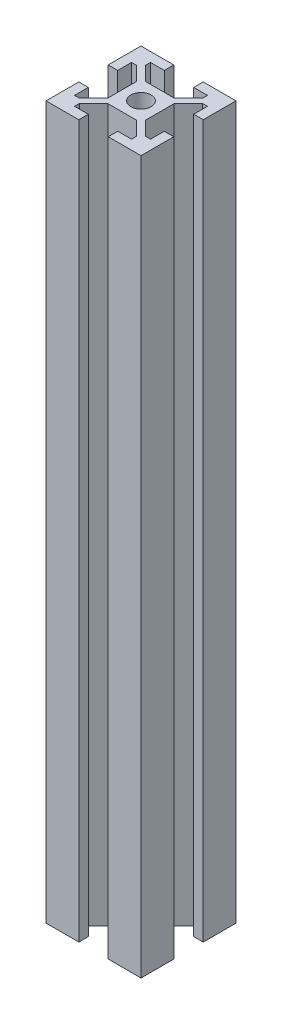
from build123d import *

# Parameters (mm, degrees)
SKETCH_1_R          = 2.15
EXTRUDE_1_DEPTH     = 150
SKETCH_3_R          = 3
CUT_EXTRUDE_1_DEPTH = 26


with BuildPart() as part:
    # 스케치1 → 보스-돌출1 (new body)
    with BuildSketch(Plane(origin=(0, 0, 0), x_dir=(1, 0, 0), z_dir=(0, 1, 0))):
        Polygon((3.1, 8), (6, 8), (6, 7), (3, 4), (0, 4), (-3, 4), (-6, 7), (-6, 8), (-3.1, 8), (-3.1, 9.998992087), (-10.001007855, 9.998992087), (-10.001007855, 3.1), (-8, 3.1), (-8, 6), (-7, 6), (-4, 3), (-4, 0), (-4, -3), (-7, -6), (-8, -6), (-8, -3.1), (-10.001007855, -3.1), (-10.001007855, -9.998992087), (-3.1, -9.998992087), (-3.1, -8), (-6, -8), (-6, -7), (-3, -4), (0, -4), (3, -4), (6, -7), (6, -8), (3.1, -8), (3.1, -9.998992087), (10.001007855, -9.998992087), (10.001007855, -3.1), (8, -3.1), (8, -6), (7, -6), (4, -3), (4, 0), (4, 3), (7, 6), (8, 6), (8, 3.1), (10.001007855, 3.1), (10.001007855, 9.998992087), (3.1, 9.998992087), align=None)
        with Locations(Location((0, 0, 0), (0, 0, 270))):
            Circle(SKETCH_1_R, mode=Mode.SUBTRACT)
    extrude(amount=EXTRUDE_1_DEPTH)

    # 스케치3 → 컷-돌출1 (cut)
    with BuildSketch(Plane(origin=(10.001007855, 0, 0), x_dir=(0, 0, -1), z_dir=(1, 0, 0))):
        with Locations((0, 75)):
            Circle(SKETCH_3_R)
    extrude(amount=-CUT_EXTRUDE_1_DEPTH, mode=Mode.SUBTRACT)


solid = part.part
